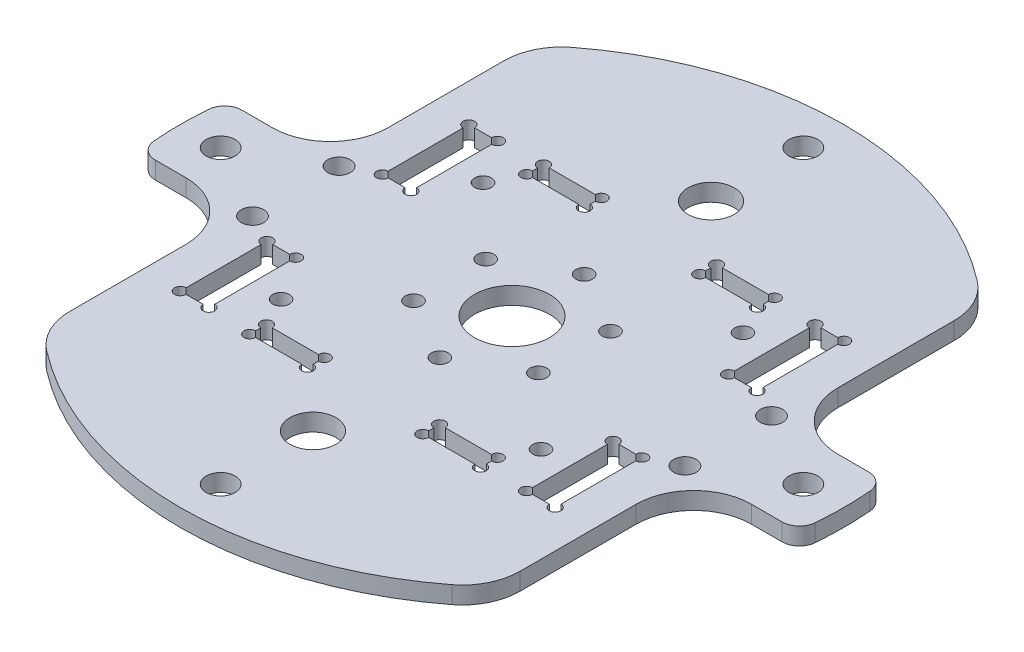
from build123d import *

# Parameters (mm, degrees)
SKETCH_1_R          = 57.5
SKETCH_1_R_2        = 2.5
EXTRUDE_1_DEPTH     = 3
SKETCH_2_R          = 1.45
CUT_EXTRUDE_1_DEPTH = 82.372599811
SKETCH_3_R          = 1.45
SKETCH_3_R_2        = 1.95
SKETCH_3_W          = 4.95
SKETCH_3_H          = 15
CUT_EXTRUDE_2_DEPTH = 82.372599811
SKETCH_4_R          = 1
CUT_EXTRUDE_3_DEPTH = 82.372599811
SKETCH_5_W          = 10
SKETCH_5_H          = 2.9
CUT_EXTRUDE_4_DEPTH = 82.372599811
SKETCH_6_R          = 1
CUT_EXTRUDE_5_DEPTH = 82.372599811
SKETCH_7_R          = 4
CUT_EXTRUDE_6_DEPTH = 82.372599811
SKETCH_8_R          = 6.5
CUT_EXTRUDE_7_DEPTH = 82.372599811
CUT_EXTRUDE_8_DEPTH = 82.372599811
FILLET_1_R          = 10
FILLET_2_R          = 3


with BuildPart() as part:
    # 草图1 → 凸台-拉伸1 (new body)
    with BuildSketch(Plane(origin=(0, 0, 0), x_dir=(1, 0, 0), z_dir=(0, 1, 0))):
        with Locations(Location((0, 0, 0), (0, 0, 270))):
            Circle(SKETCH_1_R)
        with Locations(Location((0, 50.5, 0), (0, 0, 270))):
            Circle(SKETCH_1_R_2, mode=Mode.SUBTRACT)
        with Locations(Location((50.5, 0, 0), (0, 0, 270))):
            Circle(SKETCH_1_R_2, mode=Mode.SUBTRACT)
        with Locations(Location((0, -50.5, 0), (0, 0, 270))):
            Circle(SKETCH_1_R_2, mode=Mode.SUBTRACT)
        with Locations(Location((-50.5, 0, 0), (0, 0, 270))):
            Circle(SKETCH_1_R_2, mode=Mode.SUBTRACT)
    extrude(amount=EXTRUDE_1_DEPTH)

    # 草图2 → 切除-拉伸1 (cut, through all)
    with BuildSketch(Plane(origin=(0, 3, 0), x_dir=(1, 0, 0), z_dir=(0, 1, 0))):
        with Locations(Location((0, 12.5, 0), (0, 0, 270))):
            Circle(SKETCH_2_R)
        with Locations(Location((10.825317547, 6.25, 0), (0, 0, 270))):
            Circle(SKETCH_2_R)
        with Locations(Location((10.825317547, -6.25, 0), (0, 0, 270))):
            Circle(SKETCH_2_R)
        with Locations(Location((0, -12.5, 0), (0, 0, 270))):
            Circle(SKETCH_2_R)
        with Locations(Location((-10.825317547, -6.25, 0), (0, 0, 270))):
            Circle(SKETCH_2_R)
        with Locations(Location((-10.825317547, 6.25, 0), (0, 0, 270))):
            Circle(SKETCH_2_R)
    extrude(amount=-CUT_EXTRUDE_1_DEPTH, mode=Mode.SUBTRACT)

    # 草图3 → 切除-拉伸2 (cut, through all)
    with BuildSketch(Plane(origin=(0, 3, 0), x_dir=(1, 0, 0), z_dir=(0, 1, 0))):
        with Locations(Location((22.525, 17.5, 0), (0, 0, 270))):
            Circle(SKETCH_3_R)
        with Locations(Location((22.525, -17.5, 0), (0, 0, 270))):
            Circle(SKETCH_3_R)
        with Locations(Location((-22.525, -17.5, 0), (0, 0, 90))):
            Circle(SKETCH_3_R)
        with Locations(Location((-22.525, 17.5, 0), (0, 0, 90))):
            Circle(SKETCH_3_R)
        with Locations(Location((37.475, 7.5, 0), (0, 0, 270))):
            Circle(SKETCH_3_R_2)
        with Locations(Location((37.475, -7.5, 0), (0, 0, 270))):
            Circle(SKETCH_3_R_2)
        with Locations(Location((-37.475, -7.5, 0), (0, 0, 90))):
            Circle(SKETCH_3_R_2)
        with Locations(Location((-37.475, 7.5, 0), (0, 0, 90))):
            Circle(SKETCH_3_R_2)
        with Locations((30, 17.5)):
            Rectangle(SKETCH_3_W, SKETCH_3_H)
        with Locations((30, -17.5)):
            Rectangle(SKETCH_3_W, SKETCH_3_H)
        with Locations((-30, -17.5)):
            Rectangle(SKETCH_3_W, SKETCH_3_H)
        with Locations((-30, 17.5)):
            Rectangle(SKETCH_3_W, SKETCH_3_H)
    extrude(amount=-CUT_EXTRUDE_2_DEPTH, mode=Mode.SUBTRACT)

    # 草图4 → 切除-拉伸3 (cut, through all)
    with BuildSketch(Plane(origin=(0, 3, 0), x_dir=(1, 0, 0), z_dir=(0, 1, 0))):
        with Locations((-32.475, 25)):
            Circle(SKETCH_4_R)
        with Locations((-27.525, 25)):
            Circle(SKETCH_4_R)
        with Locations((-27.525, 10)):
            Circle(SKETCH_4_R)
        with Locations((-32.475, 10)):
            Circle(SKETCH_4_R)
        with Locations((27.525, 25)):
            Circle(SKETCH_4_R)
        with Locations((32.475, 25)):
            Circle(SKETCH_4_R)
        with Locations((32.475, 10)):
            Circle(SKETCH_4_R)
        with Locations((27.525, 10)):
            Circle(SKETCH_4_R)
        with Locations((27.525, -10)):
            Circle(SKETCH_4_R)
        with Locations((32.475, -10)):
            Circle(SKETCH_4_R)
        with Locations((32.475, -25)):
            Circle(SKETCH_4_R)
        with Locations((27.525, -25)):
            Circle(SKETCH_4_R)
        with Locations((-27.525, -25)):
            Circle(SKETCH_4_R)
        with Locations((-32.475, -25)):
            Circle(SKETCH_4_R)
        with Locations((-32.475, -10)):
            Circle(SKETCH_4_R)
        with Locations((-27.525, -10)):
            Circle(SKETCH_4_R)
    extrude(amount=-CUT_EXTRUDE_3_DEPTH, mode=Mode.SUBTRACT)

    # 草图5 → 切除-拉伸4 (cut, through all)
    with BuildSketch(Plane(origin=(0, 3, 0), x_dir=(1, 0, 0), z_dir=(0, 1, 0))):
        with Locations((15, -24)):
            Rectangle(SKETCH_5_W, SKETCH_5_H)
        with Locations((-15, -24)):
            Rectangle(SKETCH_5_W, SKETCH_5_H)
        with Locations((-15, 24)):
            Rectangle(SKETCH_5_W, SKETCH_5_H)
        with Locations((15, 24)):
            Rectangle(SKETCH_5_W, SKETCH_5_H)
    extrude(amount=-CUT_EXTRUDE_4_DEPTH, mode=Mode.SUBTRACT)

    # 草图6 → 切除-拉伸5 (cut, through all)
    with BuildSketch(Plane(origin=(0, 3, 0), x_dir=(1, 0, 0), z_dir=(0, 1, 0))):
        with Locations((-20, 25.45)):
            Circle(SKETCH_6_R)
        with Locations((-10, 25.45)):
            Circle(SKETCH_6_R)
        with Locations((-10, 22.55)):
            Circle(SKETCH_6_R)
        with Locations((-20, 22.55)):
            Circle(SKETCH_6_R)
        with Locations((10, 22.55)):
            Circle(SKETCH_6_R)
        with Locations((10, 25.45)):
            Circle(SKETCH_6_R)
        with Locations((20, 25.45)):
            Circle(SKETCH_6_R)
        with Locations((20, 22.55)):
            Circle(SKETCH_6_R)
        with Locations((20, -22.55)):
            Circle(SKETCH_6_R)
        with Locations((20, -25.45)):
            Circle(SKETCH_6_R)
        with Locations((10, -25.45)):
            Circle(SKETCH_6_R)
        with Locations((10, -22.55)):
            Circle(SKETCH_6_R)
        with Locations((-10, -22.55)):
            Circle(SKETCH_6_R)
        with Locations((-10, -25.45)):
            Circle(SKETCH_6_R)
        with Locations((-20, -25.45)):
            Circle(SKETCH_6_R)
        with Locations((-20, -22.55)):
            Circle(SKETCH_6_R)
    extrude(amount=-CUT_EXTRUDE_5_DEPTH, mode=Mode.SUBTRACT)

    # 草图7 → 切除-拉伸6 (cut, through all)
    with BuildSketch(Plane(origin=(0, 3, 0), x_dir=(1, 0, 0), z_dir=(0, 1, 0))):
        with Locations(Location((0, 34.5, 0), (0, 0, 270))):
            Circle(SKETCH_7_R)
        with Locations(Location((0, -34.5, 0), (0, 0, 270))):
            Circle(SKETCH_7_R)
    extrude(amount=-CUT_EXTRUDE_6_DEPTH, mode=Mode.SUBTRACT)

    # 草图8 → 切除-拉伸7 (cut, through all)
    with BuildSketch(Plane(origin=(0, 3, 0), x_dir=(1, 0, 0), z_dir=(0, 1, 0))):
        with Locations(Location((0, 0, 0), (0, 0, 270))):
            Circle(SKETCH_8_R)
    extrude(amount=-CUT_EXTRUDE_7_DEPTH, mode=Mode.SUBTRACT)

    # 草图9 → 切除-拉伸8 (cut, through all)
    with BuildSketch(Plane(origin=(0, 3, 0), x_dir=(1, 0, 0), z_dir=(0, 1, 0))):
        with BuildLine():
            Line((-39.008771255, 30.266708508), (-39.008771255, 17.5))
            ThreePointArc((-39.008771255, 17.5), (-41.937703443, 10.428932188), (-49.008771255, 7.5))
            Line((-49.008771255, 7.5), (-57.008771255, 7.5))
            ThreePointArc((-57.008771255, 7.5), (-51.055172164, 26.45031938), (-39.008771255, 42.244121072))
            Line((-39.008771255, 42.244121072), (-39.008771255, 39.722188958))
            Line((-39.008771255, 39.722188958), (-39.008771255, 30.266708508))
        make_face()
        with BuildLine():
            Line((-57.008771255, -7.5), (-49.008771255, -7.5))
            ThreePointArc((-49.008771255, -7.5), (-41.937703443, -10.428932188), (-39.008771255, -17.5))
            Line((-39.008771255, -17.5), (-39.008771255, -30.266708508))
            Line((-39.008771255, -30.266708508), (-39.008771255, -39.722188958))
            Line((-39.008771255, -39.722188958), (-39.008771255, -42.244121072))
            ThreePointArc((-39.008771255, -42.244121072), (-51.055172164, -26.45031938), (-57.008771255, -7.5))
        make_face()
        with BuildLine():
            Line((39.008771255, -30.266708508), (39.008771255, -17.5))
            ThreePointArc((39.008771255, -17.5), (41.937703443, -10.428932188), (49.008771255, -7.5))
            Line((49.008771255, -7.5), (57.008771255, -7.5))
            ThreePointArc((57.008771255, -7.5), (51.055172164, -26.45031938), (39.008771255, -42.244121072))
            Line((39.008771255, -42.244121072), (39.008771255, -39.722188958))
            Line((39.008771255, -39.722188958), (39.008771255, -30.266708508))
        make_face()
        with BuildLine():
            Line((57.008771255, 7.5), (49.008771255, 7.5))
            ThreePointArc((49.008771255, 7.5), (41.937703443, 10.428932188), (39.008771255, 17.5))
            Line((39.008771255, 17.5), (39.008771255, 30.266708508))
            Line((39.008771255, 30.266708508), (39.008771255, 39.722188958))
            Line((39.008771255, 39.722188958), (39.008771255, 42.244121072))
            ThreePointArc((39.008771255, 42.244121072), (51.055172164, 26.45031938), (57.008771255, 7.5))
        make_face()
    extrude(amount=-CUT_EXTRUDE_8_DEPTH, mode=Mode.SUBTRACT)

    # 圆角1
    fillet_1_edges = [part.edges().sort_by_distance(p)[0] for p in [
        (-39.008771255, 1.5, 42.244121072),
        (39.008771255, 1.5, 42.244121072),
        (39.008771255, 1.5, -42.244121072),
        (-39.008771255, 1.5, -42.244121072),
    ]]
    fillet(fillet_1_edges, radius=FILLET_1_R)

    # 圆角2
    fillet_2_edges = [part.edges().sort_by_distance(p)[0] for p in [
        (-57.008771255, 1.5, 7.5),
        (57.008771255, 1.5, 7.5),
        (57.008771255, 1.5, -7.5),
        (-57.008771255, 1.5, -7.5),
    ]]
    fillet(fillet_2_edges, radius=FILLET_2_R)


solid = part.part
